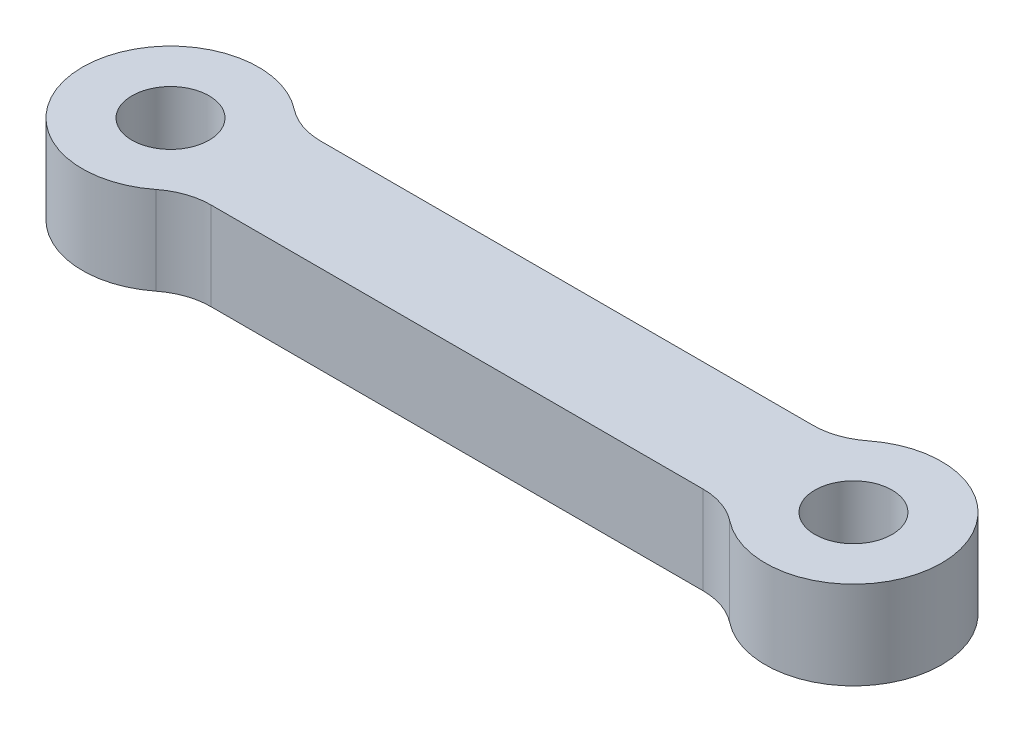
from build123d import *

# Parameters (mm, degrees)
SKETCH1_R           = 1.75
BOSS_EXTRUDE1_DEPTH = 4


with BuildPart() as part:
    # Sketch1 → Boss-Extrude1 (new body)
    with BuildSketch(Plane.XZ):
        with BuildLine():
            Line((26.669872981, 2.5), (4.330127019, 2.5))
            ThreePointArc((4.330127019, 2.5), (3.348146513, 2.665266452), (2.474358297, 3.142857143))
            ThreePointArc((2.474358297, 3.142857143), (-4, 0), (2.474358297, -3.142857143))
            ThreePointArc((2.474358297, -3.142857143), (3.348146513, -2.665266452), (4.330127019, -2.5))
            Line((4.330127019, -2.5), (26.669872981, -2.5))
            ThreePointArc((26.669872981, -2.5), (27.651853487, -2.665266452), (28.525641703, -3.142857143))
            ThreePointArc((28.525641703, -3.142857143), (35, 0), (28.525641703, 3.142857143))
            ThreePointArc((28.525641703, 3.142857143), (27.651853487, 2.665266452), (26.669872981, 2.5))
        make_face()
        with Locations(Location((31, 0, 0), (0, 0, 90))):
            Circle(SKETCH1_R, mode=Mode.SUBTRACT)
        with Locations(Location((0, 0, 0), (0, 0, 90))):
            Circle(SKETCH1_R, mode=Mode.SUBTRACT)
    extrude(amount=-BOSS_EXTRUDE1_DEPTH)


solid = part.part
